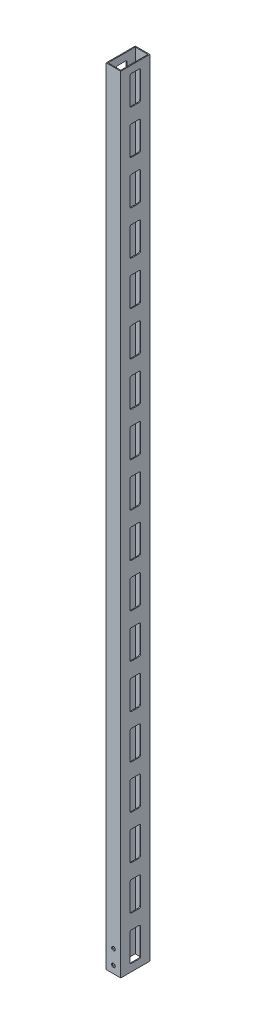
from build123d import *

# Parameters (mm, degrees)
SKETCH2_W           = 25.4
SKETCH2_H           = 50.8
SKETCH2_W_2         = 22.225
SKETCH2_H_2         = 47.625
BOSS_EXTRUDE1_DEPTH = 1371.6
SKETCH3_R           = 3.175
CUT_EXTRUDE1_DEPTH  = 1479.350372036
CUT_EXTRUDE2_DEPTH  = 1456.466543758
LPATTERN1_COUNT     = 18
LPATTERN1_PITCH     = 76.2


with BuildPart() as part:
    # Sketch2 → Boss-Extrude1 (new body)
    with BuildSketch(Plane(origin=(0, 63.5, 0), x_dir=(-1, 0, 0), z_dir=(0, -1, 0))):
        with Locations((-247.65, 215.9)):
            Rectangle(SKETCH2_W, SKETCH2_H)
        with Locations((-247.65, 215.9)):
            Rectangle(SKETCH2_W_2, SKETCH2_H_2, mode=Mode.SUBTRACT)
    extrude(amount=-BOSS_EXTRUDE1_DEPTH)

    # Sketch3 → Cut-Extrude1 (cut, through all)
    with BuildSketch(Plane.XY):
        with Locations((247.65, 76.2)):
            Circle(SKETCH3_R)
        with Locations((247.65, 101.6)):
            Circle(SKETCH3_R)
    extrude(amount=-CUT_EXTRUDE1_DEPTH, mode=Mode.SUBTRACT)

    # Sketch4 → Cut-Extrude2 (cut, through all)
    with BuildSketch(Plane(origin=(260.35, 0, 0), x_dir=(0, 0, -1), z_dir=(1, 0, 0))):
        with BuildLine():
            Line((222.25, 127), (209.55, 127))
            ThreePointArc((209.55, 127), (207.30493597, 126.07006403), (206.375, 123.825))
            Line((206.375, 123.825), (206.375, 79.375))
            ThreePointArc((206.375, 79.375), (207.30493597, 77.12993597), (209.55, 76.2))
            Line((209.55, 76.2), (222.25, 76.2))
            ThreePointArc((222.25, 76.2), (224.49506403, 77.12993597), (225.425, 79.375))
            Line((225.425, 79.375), (225.425, 123.825))
            ThreePointArc((225.425, 123.825), (224.49506403, 126.07006403), (222.25, 127))
        make_face()
    cut_extrude2 = extrude(amount=-CUT_EXTRUDE2_DEPTH, mode=Mode.SUBTRACT)

    # LPattern1: Cut-Extrude2 ×18
    with Locations(*[(0, i * LPATTERN1_PITCH, 0) for i in range(1, LPATTERN1_COUNT)]):
        add(cut_extrude2, mode=Mode.SUBTRACT)


solid = part.part
